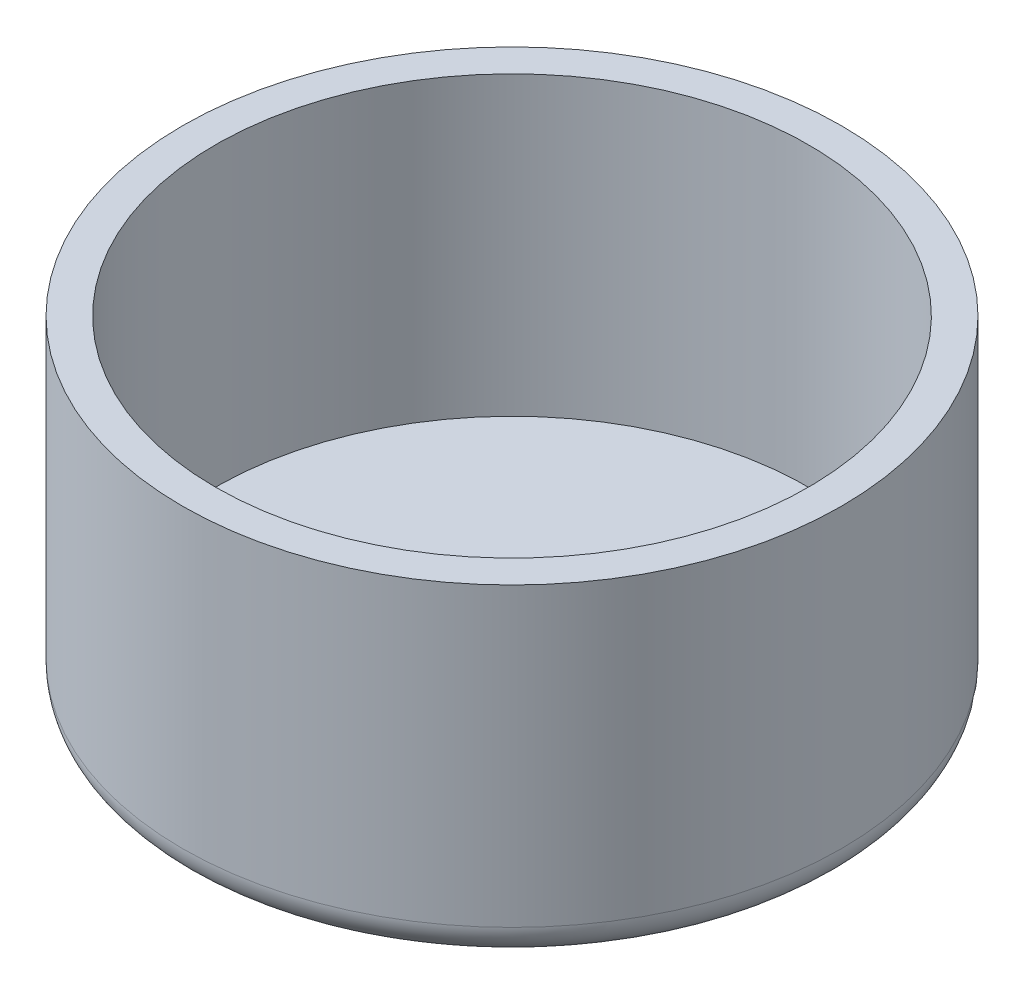
from build123d import *

# Parameters (mm, degrees)
SKETCH1_R           = 100
BOSS_EXTRUDE1_DEPTH = 100
SKETCH2_R           = 90
CUT_EXTRUDE1_DEPTH  = 90
FILLET1_R           = 10
SKETCH3_R           = 5
BOSS_EXTRUDE2_DEPTH = 5
SKETCH4_R           = 3
CUT_EXTRUDE2_DEPTH  = 5


with BuildPart() as part:
    # Sketch1 → Boss-Extrude1 (new body)
    with BuildSketch(Plane(origin=(0, 0, 0), x_dir=(1, 0, 0), z_dir=(0, 1, 0))):
        with Locations(Location((0, 0, 0), (0, 0, 270))):
            Circle(SKETCH1_R)
    extrude(amount=BOSS_EXTRUDE1_DEPTH)

    # Sketch2 → Cut-Extrude1 (cut)
    with BuildSketch(Plane(origin=(0, 100, 0), x_dir=(1, 0, 0), z_dir=(0, 1, 0))):
        with Locations(Location((0, 0, 0), (0, 0, 270))):
            Circle(SKETCH2_R)
    extrude(amount=-CUT_EXTRUDE1_DEPTH, mode=Mode.SUBTRACT)

    # Fillet1
    fillet1_edges = [part.edges().sort_by_distance(p)[0] for p in [
        (0, 0, -100),
    ]]
    fillet(fillet1_edges, radius=FILLET1_R)

    # Sketch3 → Boss-Extrude2 (add)
    with BuildSketch(Plane.XZ):
        with Locations(Location((0, 0, 0), (0, 0, 90))):
            Circle(SKETCH3_R)
    extrude(amount=BOSS_EXTRUDE2_DEPTH)

    # Sketch4 → Cut-Extrude2 (cut)
    with BuildSketch(Plane(origin=(0, -5, 0), x_dir=(-1, 0, 0), z_dir=(0, -1, 0))):
        with Locations(Location((0, 0, 0), (0, 0, 90))):
            Circle(SKETCH4_R)
    extrude(amount=-CUT_EXTRUDE2_DEPTH, mode=Mode.SUBTRACT)


solid = part.part
